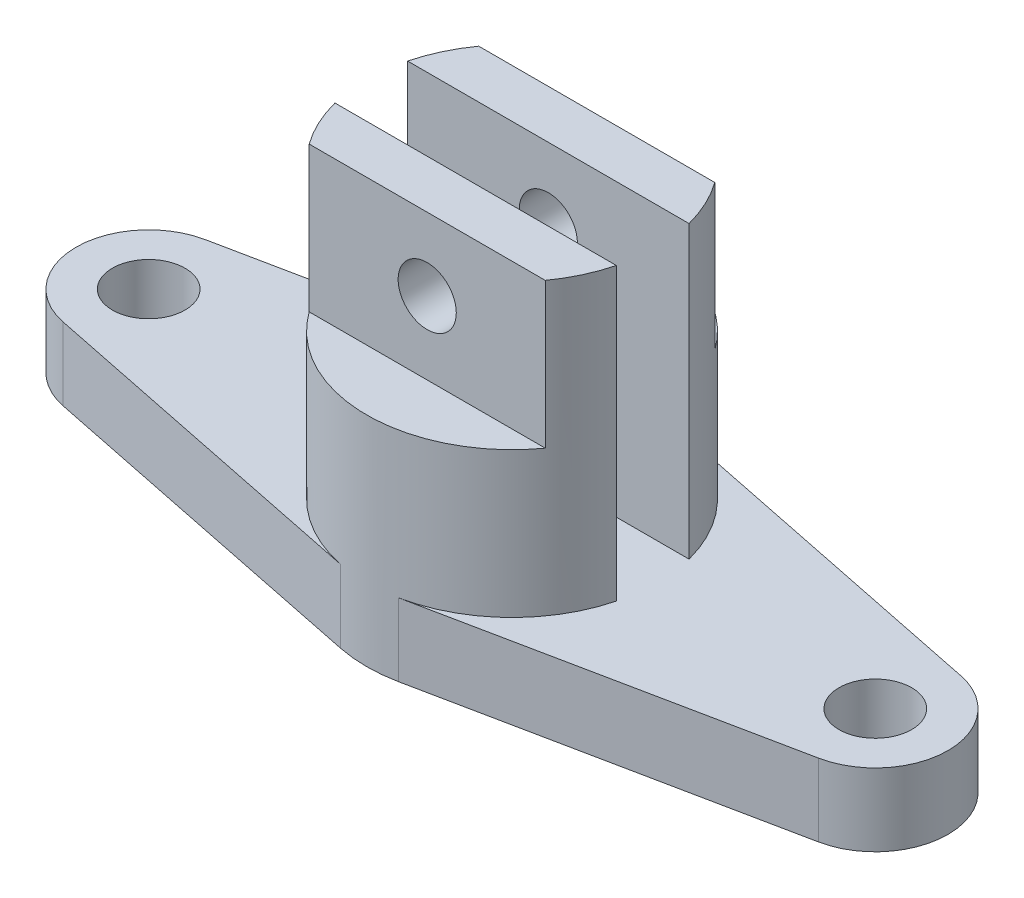
from build123d import *

# Parameters (mm, degrees)
SKETCH1_R               = 7.5
BOSS_EXTRUDE1_DEPTH     = 15
BOSS_EXTRUDE2_DEPTH     = 60
CUT_EXTRUDE2_START      = -30
CUT_EXTRUDE2_DEPTH      = 30
CUT_EXTRUDE3_DEPTH      = 127.416968798
CUT_EXTRUDE3_DEPTH_BACK = 127.416968798
SKETCH5_R               = 6


with BuildPart() as part:
    # Sketch1 → Boss-Extrude1 (new body)
    with BuildSketch(Plane(origin=(0, 0, 0), x_dir=(1, 0, 0), z_dir=(0, 1, 0))):
        with BuildLine():
            Line((-6, 29.393876913), (-78, 14.696938457))
            ThreePointArc((-78, 14.696938457), (-90, 0), (-78, -14.696938457))
            Line((-78, -14.696938457), (-6, -29.393876913))
            ThreePointArc((-6, -29.393876913), (0, -30), (6, -29.393876913))
            Line((6, -29.393876913), (78, -14.696938457))
            ThreePointArc((78, -14.696938457), (90, 0), (78, 14.696938457))
            Line((78, 14.696938457), (6, 29.393876913))
            ThreePointArc((6, 29.393876913), (0, 30), (-6, 29.393876913))
        make_face()
        with Locations(Location((-75, 0, 0), (0, 0, 270))):
            Circle(SKETCH1_R, mode=Mode.SUBTRACT)
        with Locations(Location((75, 0, 0), (0, 0, 90))):
            Circle(SKETCH1_R, mode=Mode.SUBTRACT)
    extrude(amount=BOSS_EXTRUDE1_DEPTH)

    # Sketch2 → Boss-Extrude2 (add)
    with BuildSketch(Plane(origin=(0, 15, 0), x_dir=(1, 0, 0), z_dir=(0, 1, 0))):
        with BuildLine():
            Line((-29.047375097, -7.5), (29.047375097, -7.5))
            ThreePointArc((29.047375097, -7.5), (0, -30), (-29.047375097, -7.5))
        make_face()
    boss_extrude2 = extrude(amount=BOSS_EXTRUDE2_DEPTH)

    # Sketch4 → Cut-Extrude2 (cut)
    with BuildSketch(Plane(origin=(0, 75, 0), x_dir=(1, 0, 0), z_dir=(0, 1, 0)).offset(CUT_EXTRUDE2_START)):
        with BuildLine():
            Line((-24.366985862, -17.5), (24.366985862, -17.5))
            ThreePointArc((24.366985862, -17.5), (0, -30), (-24.366985862, -17.5))
        make_face()
    cut_extrude2 = extrude(amount=CUT_EXTRUDE2_DEPTH, mode=Mode.SUBTRACT)

    # Mirror2: Boss-Extrude2 across plane
    add(boss_extrude2.mirror(Plane.XY))

    # Mirror3: Cut-Extrude2 across plane
    add(cut_extrude2.mirror(Plane.XY), mode=Mode.SUBTRACT)

    # Sketch5 → Cut-Extrude3 (cut, two sides: drawn at the far end of the back side and taken through both)
    with BuildSketch(Plane.XY.offset(17.5).offset(-CUT_EXTRUDE3_DEPTH_BACK)):
        with Locations((0, 60)):
            Circle(SKETCH5_R)
    extrude(amount=CUT_EXTRUDE3_DEPTH + CUT_EXTRUDE3_DEPTH_BACK, mode=Mode.SUBTRACT)


solid = part.part
